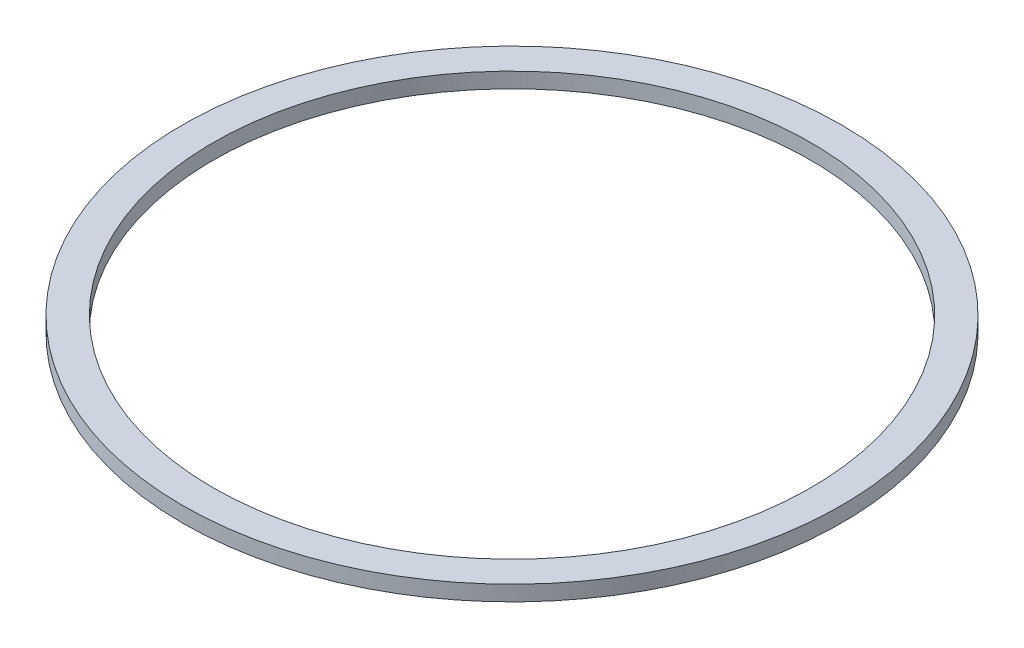
from build123d import *

# Parameters (mm, degrees)
SKETCH_1_R      = 21.5
SKETCH_1_R_2    = 19.5
EXTRUDE_1_DEPTH = 1


with BuildPart() as part:
    # 草图1 → 凸台-拉伸1 (new body)
    with BuildSketch(Plane(origin=(0, 0, 0), x_dir=(1, 0, 0), z_dir=(0, 1, 0))):
        with Locations(Location((0, 0, 0), (0, 0, 270))):
            Circle(SKETCH_1_R)
        with Locations(Location((0, 0, 0), (0, 0, 270))):
            Circle(SKETCH_1_R_2, mode=Mode.SUBTRACT)
    extrude(amount=EXTRUDE_1_DEPTH)


solid = part.part
